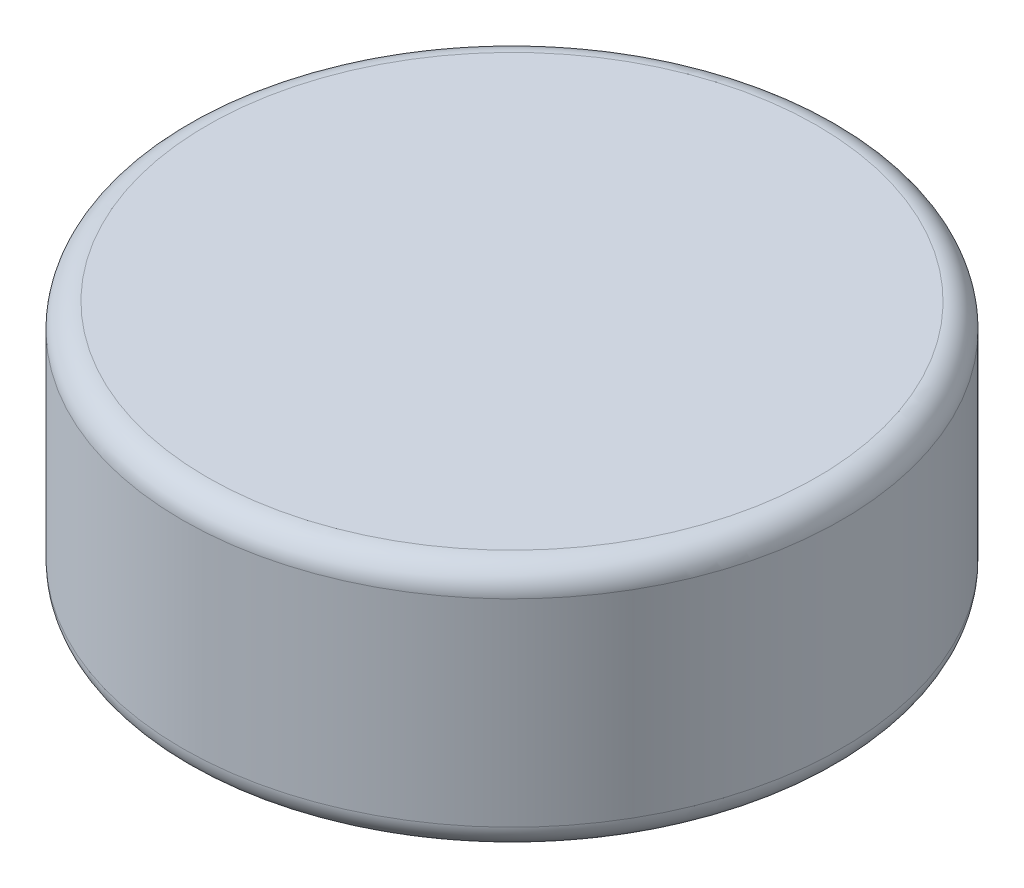
from build123d import *

# Parameters (mm, degrees)
SKETCH1_R           = 6.35
BOSS_EXTRUDE1_DEPTH = 2.38125
FILLET1_R           = 0.47625


with BuildPart() as part:
    # Sketch1 → Boss-Extrude1 (new, symmetric)
    with BuildSketch(Plane(origin=(0, 0, 0), x_dir=(1, 0, 0), z_dir=(0, 1, 0))):
        with Locations(Location((0, 0, 0), (0, 0, 90))):
            Circle(SKETCH1_R)
    extrude(amount=BOSS_EXTRUDE1_DEPTH, both=True)

    # Fillet1
    fillet1_edges = [part.edges().sort_by_distance(p)[0] for p in [
        (0, -2.38125, 6.35),
        (0, 2.38125, 6.35),
    ]]
    fillet(fillet1_edges, radius=FILLET1_R)


solid = part.part
